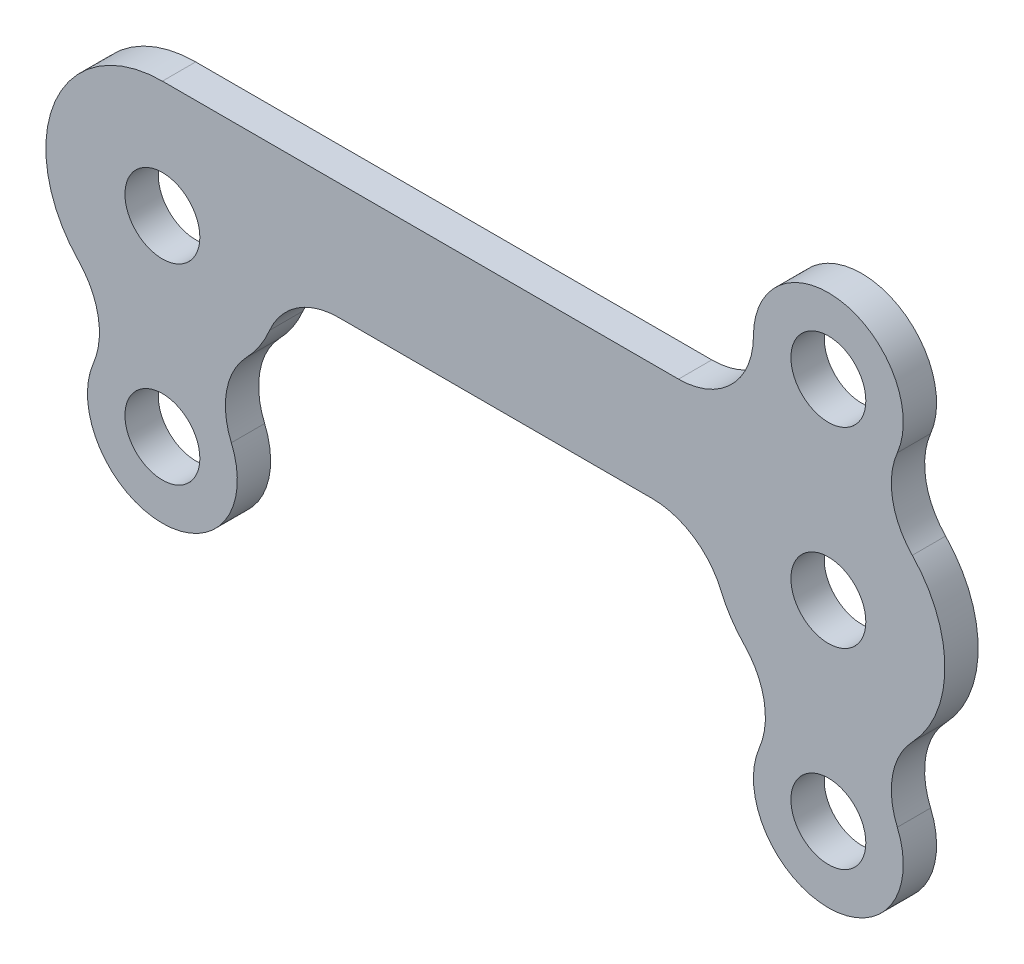
from build123d import *

# Parameters (mm, degrees)
SKETCH1_R           = 1.7859375
SKETCH1_R_2         = 3.571875
BOSS_EXTRUDE1_DEPTH = 1.5875
FILLET1_R           = 3.571875


with BuildPart() as part:
    # Sketch1 → Boss-Extrude1 (new body)
    # profile 1 of 10: a face of its own
    with BuildSketch(Plane.XY):
        with BuildLine():
            Line((5.55625, 0), (26.19375, 0))
            ThreePointArc((26.19375, 0), (27.821137947, -3.928862053), (31.75, -5.55625))
            ThreePointArc((31.75, -5.55625), (37.30625, 0), (31.75, 5.55625))
            Line((31.75, 5.55625), (0, 5.55625))
            ThreePointArc((0, 5.55625), (-5.55625, 0), (0, -5.55625))
            ThreePointArc((0, -5.55625), (3.928862053, -3.928862053), (5.55625, 0))
        make_face()
        Circle(SKETCH1_R, mode=Mode.SUBTRACT)
        with Locations((31.75, 0)):
            Circle(SKETCH1_R, mode=Mode.SUBTRACT)
    # profile 2 of 10: a face of its own
    with BuildSketch(Plane.XY):
        with Locations((0, -9.128125)):
            Circle(SKETCH1_R_2)
        with Locations((0, -9.128125)):
            Circle(SKETCH1_R, mode=Mode.SUBTRACT)
    # profile 3 of 10: a face of its own
    with BuildSketch(Plane.XY):
        with Locations((31.75, -9.128125)):
            Circle(SKETCH1_R_2)
        with Locations((31.75, -9.128125)):
            Circle(SKETCH1_R, mode=Mode.SUBTRACT)
    # profile 4 of 10: a face of its own
    with BuildSketch(Plane.XY):
        with Locations((31.75, 9.128125)):
            Circle(SKETCH1_R_2)
        with Locations((31.75, 9.128125)):
            Circle(SKETCH1_R, mode=Mode.SUBTRACT)
    # profile 5 of 10: a face of its own
    with BuildSketch(Plane.XY):
        with BuildLine():
            ThreePointArc((-3.287058415, -7.730434766), (-1.970522292, -6.148975304), (0, -5.55625))
            ThreePointArc((0, -5.55625), (-2.174184817, -5.113201976), (-4.001636392, -3.85471403))
            ThreePointArc((-4.001636392, -3.85471403), (-3.261499327, -4.996759461), (-3.002241845, -6.332744565))
            ThreePointArc((-3.002241845, -6.332744565), (-3.074170213, -7.045951824), (-3.287058415, -7.730434766))
        make_face()
    # profile 6 of 10: a face of its own
    with BuildSketch(Plane.XY):
        with BuildLine():
            ThreePointArc((3.287058355, -7.730434623), (3.061446649, -5.685103375), (4.001636153, -3.854714277))
            ThreePointArc((4.001636153, -3.854714277), (2.174184659, -5.113202043), (0, -5.55625))
            ThreePointArc((0, -5.55625), (1.970522228, -6.148975261), (3.287058355, -7.730434623))
        make_face()
    # profile 7 of 10: a face of its own
    with BuildSketch(Plane.XY):
        with BuildLine():
            ThreePointArc((31.75, -5.55625), (29.57581522, -5.113201992), (27.748363664, -3.854714088))
            ThreePointArc((27.748363664, -3.854714088), (28.488500688, -4.996759498), (28.747758155, -6.332744565))
            ThreePointArc((28.747758155, -6.332744565), (28.675829785, -7.045951831), (28.462941579, -7.730434779))
            ThreePointArc((28.462941579, -7.730434779), (29.779477702, -6.148975308), (31.75, -5.55625))
        make_face()
    # profile 8 of 10: a face of its own
    with BuildSketch(Plane.XY):
        with BuildLine():
            ThreePointArc((35.751636398, -3.854714023), (33.924184821, -5.113201974), (31.75, -5.55625))
            ThreePointArc((31.75, -5.55625), (33.720522332, -6.14897533), (35.037058453, -7.730434854))
            ThreePointArc((35.037058453, -7.730434854), (34.811446658, -5.685103325), (35.751636398, -3.854714023))
        make_face()
    # profile 9 of 10: a face of its own
    with BuildSketch(Plane.XY):
        with BuildLine():
            ThreePointArc((31.75, 5.55625), (33.924184775, 5.113201993), (35.751636329, 3.854714095))
            ThreePointArc((35.751636329, 3.854714095), (34.811446649, 5.685103374), (35.037058453, 7.730434854))
            ThreePointArc((35.037058453, 7.730434854), (33.720522332, 6.14897533), (31.75, 5.55625))
        make_face()
    # profile 10 of 10: a face of its own
    with BuildSketch(Plane.XY):
        with BuildLine():
            ThreePointArc((28.178125, 9.128125), (27.131947034, 6.602427966), (24.60625, 5.55625))
            Line((24.60625, 5.55625), (31.75, 5.55625))
            ThreePointArc((31.75, 5.55625), (29.224302966, 6.602427966), (28.178125, 9.128125))
        make_face()
    extrude(amount=BOSS_EXTRUDE1_DEPTH)

    # Fillet1
    fillet1_edges = [part.edges().sort_by_distance(p)[0] for p in [
        (26.19375, 0, 0.79375),
        (5.55625, 0, 0.79375),
    ]]
    fillet(fillet1_edges, radius=FILLET1_R)


solid = part.part
